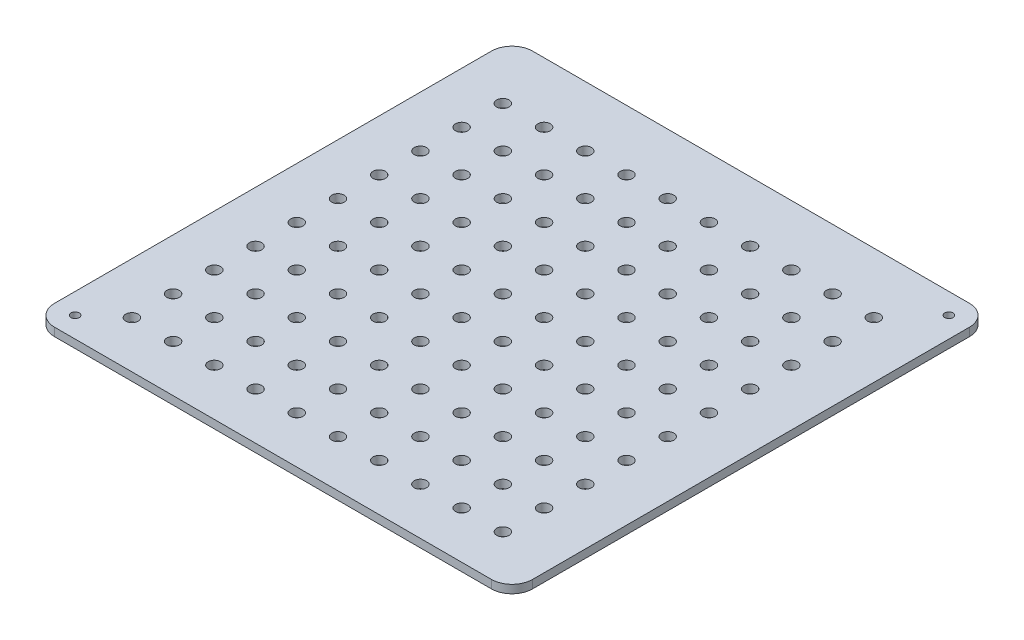
from build123d import *

# Parameters (mm, degrees)
BOSS_EXTRUDE1_DEPTH = 2
SKETCH2_R           = 1.5
CUT_EXTRUDE1_DEPTH  = 83.048765987
SKETCH3_R           = 1
CUT_EXTRUDE2_DEPTH  = 83.048765987


with BuildPart() as part:
    # Sketch1 → Boss-Extrude1 (new body)
    with BuildSketch(Plane(origin=(0, 0, 0), x_dir=(1, 0, 0), z_dir=(0, 1, 0))):
        with BuildLine():
            Line((53, 58), (-53, 58))
            ThreePointArc((-53, 58), (-56.535533906, 56.535533906), (-58, 53))
            Line((-58, 53), (-58, -53))
            ThreePointArc((-58, -53), (-56.535533906, -56.535533906), (-53, -58))
            Line((-53, -58), (53, -58))
            ThreePointArc((53, -58), (56.535533906, -56.535533906), (58, -53))
            Line((58, -53), (58, 53))
            ThreePointArc((58, 53), (56.535533906, 56.535533906), (53, 58))
        make_face()
    extrude(amount=BOSS_EXTRUDE1_DEPTH)

    # Sketch2 → Cut-Extrude1 (cut, through all)
    with BuildSketch(Plane(origin=(0, 2, 0), x_dir=(1, 0, 0), z_dir=(0, 1, 0))):
        with Locations(Location((-45.60494968, 43.386330507, 0), (0, 0, 270))):
            Circle(SKETCH2_R)
        with Locations(Location((-35.60494968, 43.386330507, 0), (0, 0, 270))):
            Circle(SKETCH2_R)
        with Locations(Location((-25.60494968, 43.386330507, 0), (0, 0, 270))):
            Circle(SKETCH2_R)
        with Locations(Location((-15.60494968, 43.386330507, 0), (0, 0, 270))):
            Circle(SKETCH2_R)
        with Locations(Location((-5.60494968, 43.386330507, 0), (0, 0, 270))):
            Circle(SKETCH2_R)
        with Locations(Location((4.39505032, 43.386330507, 0), (0, 0, 270))):
            Circle(SKETCH2_R)
        with Locations(Location((14.39505032, 43.386330507, 0), (0, 0, 270))):
            Circle(SKETCH2_R)
        with Locations(Location((24.39505032, 43.386330507, 0), (0, 0, 270))):
            Circle(SKETCH2_R)
        with Locations(Location((34.39505032, 43.386330507, 0), (0, 0, 270))):
            Circle(SKETCH2_R)
        with Locations(Location((44.39505032, 43.386330507, 0), (0, 0, 270))):
            Circle(SKETCH2_R)
        with Locations(Location((-35.60494968, 33.386330507, 0), (0, 0, 270))):
            Circle(SKETCH2_R)
        with Locations(Location((-25.60494968, 33.386330507, 0), (0, 0, 270))):
            Circle(SKETCH2_R)
        with Locations(Location((-15.60494968, 33.386330507, 0), (0, 0, 270))):
            Circle(SKETCH2_R)
        with Locations(Location((-5.60494968, 33.386330507, 0), (0, 0, 270))):
            Circle(SKETCH2_R)
        with Locations(Location((4.39505032, 33.386330507, 0), (0, 0, 270))):
            Circle(SKETCH2_R)
        with Locations(Location((14.39505032, 33.386330507, 0), (0, 0, 270))):
            Circle(SKETCH2_R)
        with Locations(Location((24.39505032, 33.386330507, 0), (0, 0, 270))):
            Circle(SKETCH2_R)
        with Locations(Location((34.39505032, 33.386330507, 0), (0, 0, 270))):
            Circle(SKETCH2_R)
        with Locations(Location((44.39505032, 33.386330507, 0), (0, 0, 270))):
            Circle(SKETCH2_R)
        with Locations(Location((-35.60494968, 23.386330507, 0), (0, 0, 270))):
            Circle(SKETCH2_R)
        with Locations(Location((-25.60494968, 23.386330507, 0), (0, 0, 270))):
            Circle(SKETCH2_R)
        with Locations(Location((-15.60494968, 23.386330507, 0), (0, 0, 270))):
            Circle(SKETCH2_R)
        with Locations(Location((-5.60494968, 23.386330507, 0), (0, 0, 270))):
            Circle(SKETCH2_R)
        with Locations(Location((4.39505032, 23.386330507, 0), (0, 0, 270))):
            Circle(SKETCH2_R)
        with Locations(Location((14.39505032, 23.386330507, 0), (0, 0, 270))):
            Circle(SKETCH2_R)
        with Locations(Location((24.39505032, 23.386330507, 0), (0, 0, 270))):
            Circle(SKETCH2_R)
        with Locations(Location((34.39505032, 23.386330507, 0), (0, 0, 270))):
            Circle(SKETCH2_R)
        with Locations(Location((44.39505032, 23.386330507, 0), (0, 0, 270))):
            Circle(SKETCH2_R)
        with Locations(Location((-35.60494968, 13.386330507, 0), (0, 0, 270))):
            Circle(SKETCH2_R)
        with Locations(Location((-25.60494968, 13.386330507, 0), (0, 0, 270))):
            Circle(SKETCH2_R)
        with Locations(Location((-15.60494968, 13.386330507, 0), (0, 0, 270))):
            Circle(SKETCH2_R)
        with Locations(Location((-5.60494968, 13.386330507, 0), (0, 0, 270))):
            Circle(SKETCH2_R)
        with Locations(Location((4.39505032, 13.386330507, 0), (0, 0, 270))):
            Circle(SKETCH2_R)
        with Locations(Location((14.39505032, 13.386330507, 0), (0, 0, 270))):
            Circle(SKETCH2_R)
        with Locations(Location((24.39505032, 13.386330507, 0), (0, 0, 270))):
            Circle(SKETCH2_R)
        with Locations(Location((34.39505032, 13.386330507, 0), (0, 0, 270))):
            Circle(SKETCH2_R)
        with Locations(Location((44.39505032, 13.386330507, 0), (0, 0, 270))):
            Circle(SKETCH2_R)
        with Locations(Location((-35.60494968, 3.386330507, 0), (0, 0, 270))):
            Circle(SKETCH2_R)
        with Locations(Location((-25.60494968, 3.386330507, 0), (0, 0, 270))):
            Circle(SKETCH2_R)
        with Locations(Location((-15.60494968, 3.386330507, 0), (0, 0, 270))):
            Circle(SKETCH2_R)
        with Locations(Location((-5.60494968, 3.386330507, 0), (0, 0, 270))):
            Circle(SKETCH2_R)
        with Locations(Location((4.39505032, 3.386330507, 0), (0, 0, 270))):
            Circle(SKETCH2_R)
        with Locations(Location((14.39505032, 3.386330507, 0), (0, 0, 270))):
            Circle(SKETCH2_R)
        with Locations(Location((24.39505032, 3.386330507, 0), (0, 0, 270))):
            Circle(SKETCH2_R)
        with Locations(Location((34.39505032, 3.386330507, 0), (0, 0, 270))):
            Circle(SKETCH2_R)
        with Locations(Location((44.39505032, 3.386330507, 0), (0, 0, 270))):
            Circle(SKETCH2_R)
        with Locations(Location((-35.60494968, -6.613669493, 0), (0, 0, 270))):
            Circle(SKETCH2_R)
        with Locations(Location((-25.60494968, -6.613669493, 0), (0, 0, 270))):
            Circle(SKETCH2_R)
        with Locations(Location((-15.60494968, -6.613669493, 0), (0, 0, 270))):
            Circle(SKETCH2_R)
        with Locations(Location((-5.60494968, -6.613669493, 0), (0, 0, 270))):
            Circle(SKETCH2_R)
        with Locations(Location((4.39505032, -6.613669493, 0), (0, 0, 270))):
            Circle(SKETCH2_R)
        with Locations(Location((14.39505032, -6.613669493, 0), (0, 0, 270))):
            Circle(SKETCH2_R)
        with Locations(Location((24.39505032, -6.613669493, 0), (0, 0, 270))):
            Circle(SKETCH2_R)
        with Locations(Location((34.39505032, -6.613669493, 0), (0, 0, 270))):
            Circle(SKETCH2_R)
        with Locations(Location((44.39505032, -6.613669493, 0), (0, 0, 270))):
            Circle(SKETCH2_R)
        with Locations(Location((-35.60494968, -16.613669493, 0), (0, 0, 270))):
            Circle(SKETCH2_R)
        with Locations(Location((-25.60494968, -16.613669493, 0), (0, 0, 270))):
            Circle(SKETCH2_R)
        with Locations(Location((-15.60494968, -16.613669493, 0), (0, 0, 270))):
            Circle(SKETCH2_R)
        with Locations(Location((-5.60494968, -16.613669493, 0), (0, 0, 270))):
            Circle(SKETCH2_R)
        with Locations(Location((4.39505032, -16.613669493, 0), (0, 0, 270))):
            Circle(SKETCH2_R)
        with Locations(Location((14.39505032, -16.613669493, 0), (0, 0, 270))):
            Circle(SKETCH2_R)
        with Locations(Location((24.39505032, -16.613669493, 0), (0, 0, 270))):
            Circle(SKETCH2_R)
        with Locations(Location((34.39505032, -16.613669493, 0), (0, 0, 270))):
            Circle(SKETCH2_R)
        with Locations(Location((44.39505032, -16.613669493, 0), (0, 0, 270))):
            Circle(SKETCH2_R)
        with Locations(Location((-35.60494968, -26.613669493, 0), (0, 0, 270))):
            Circle(SKETCH2_R)
        with Locations(Location((-25.60494968, -26.613669493, 0), (0, 0, 270))):
            Circle(SKETCH2_R)
        with Locations(Location((-15.60494968, -26.613669493, 0), (0, 0, 270))):
            Circle(SKETCH2_R)
        with Locations(Location((-5.60494968, -26.613669493, 0), (0, 0, 270))):
            Circle(SKETCH2_R)
        with Locations(Location((4.39505032, -26.613669493, 0), (0, 0, 270))):
            Circle(SKETCH2_R)
        with Locations(Location((14.39505032, -26.613669493, 0), (0, 0, 270))):
            Circle(SKETCH2_R)
        with Locations(Location((24.39505032, -26.613669493, 0), (0, 0, 270))):
            Circle(SKETCH2_R)
        with Locations(Location((34.39505032, -26.613669493, 0), (0, 0, 270))):
            Circle(SKETCH2_R)
        with Locations(Location((44.39505032, -26.613669493, 0), (0, 0, 270))):
            Circle(SKETCH2_R)
        with Locations(Location((-35.60494968, -36.613669493, 0), (0, 0, 270))):
            Circle(SKETCH2_R)
        with Locations(Location((-25.60494968, -36.613669493, 0), (0, 0, 270))):
            Circle(SKETCH2_R)
        with Locations(Location((-15.60494968, -36.613669493, 0), (0, 0, 270))):
            Circle(SKETCH2_R)
        with Locations(Location((-5.60494968, -36.613669493, 0), (0, 0, 270))):
            Circle(SKETCH2_R)
        with Locations(Location((4.39505032, -36.613669493, 0), (0, 0, 270))):
            Circle(SKETCH2_R)
        with Locations(Location((14.39505032, -36.613669493, 0), (0, 0, 270))):
            Circle(SKETCH2_R)
        with Locations(Location((24.39505032, -36.613669493, 0), (0, 0, 270))):
            Circle(SKETCH2_R)
        with Locations(Location((34.39505032, -36.613669493, 0), (0, 0, 270))):
            Circle(SKETCH2_R)
        with Locations(Location((44.39505032, -36.613669493, 0), (0, 0, 270))):
            Circle(SKETCH2_R)
        with Locations(Location((-35.60494968, -46.613669493, 0), (0, 0, 270))):
            Circle(SKETCH2_R)
        with Locations(Location((-25.60494968, -46.613669493, 0), (0, 0, 270))):
            Circle(SKETCH2_R)
        with Locations(Location((-15.60494968, -46.613669493, 0), (0, 0, 270))):
            Circle(SKETCH2_R)
        with Locations(Location((-5.60494968, -46.613669493, 0), (0, 0, 270))):
            Circle(SKETCH2_R)
        with Locations(Location((4.39505032, -46.613669493, 0), (0, 0, 270))):
            Circle(SKETCH2_R)
        with Locations(Location((14.39505032, -46.613669493, 0), (0, 0, 270))):
            Circle(SKETCH2_R)
        with Locations(Location((24.39505032, -46.613669493, 0), (0, 0, 270))):
            Circle(SKETCH2_R)
        with Locations(Location((34.39505032, -46.613669493, 0), (0, 0, 270))):
            Circle(SKETCH2_R)
        with Locations(Location((44.39505032, -46.613669493, 0), (0, 0, 270))):
            Circle(SKETCH2_R)
        with Locations(Location((-45.60494968, 33.386330507, 0), (0, 0, 270))):
            Circle(SKETCH2_R)
        with Locations(Location((-45.60494968, 23.386330507, 0), (0, 0, 270))):
            Circle(SKETCH2_R)
        with Locations(Location((-45.60494968, 13.386330507, 0), (0, 0, 270))):
            Circle(SKETCH2_R)
        with Locations(Location((-45.60494968, 3.386330507, 0), (0, 0, 270))):
            Circle(SKETCH2_R)
        with Locations(Location((-45.60494968, -6.613669493, 0), (0, 0, 270))):
            Circle(SKETCH2_R)
        with Locations(Location((-45.60494968, -16.613669493, 0), (0, 0, 270))):
            Circle(SKETCH2_R)
        with Locations(Location((-45.60494968, -26.613669493, 0), (0, 0, 270))):
            Circle(SKETCH2_R)
        with Locations(Location((-45.60494968, -36.613669493, 0), (0, 0, 270))):
            Circle(SKETCH2_R)
        with Locations(Location((-45.60494968, -46.613669493, 0), (0, 0, 270))):
            Circle(SKETCH2_R)
    extrude(amount=-CUT_EXTRUDE1_DEPTH, mode=Mode.SUBTRACT)

    # Sketch3 → Cut-Extrude2 (cut, through all)
    with BuildSketch(Plane.XZ):
        with Locations(Location((-53, 53, 0), (0, 0, 270))):
            Circle(SKETCH3_R)
        with Locations(Location((53, -53, 0), (0, 0, 270))):
            Circle(SKETCH3_R)
    extrude(amount=-CUT_EXTRUDE2_DEPTH, mode=Mode.SUBTRACT)


solid = part.part
